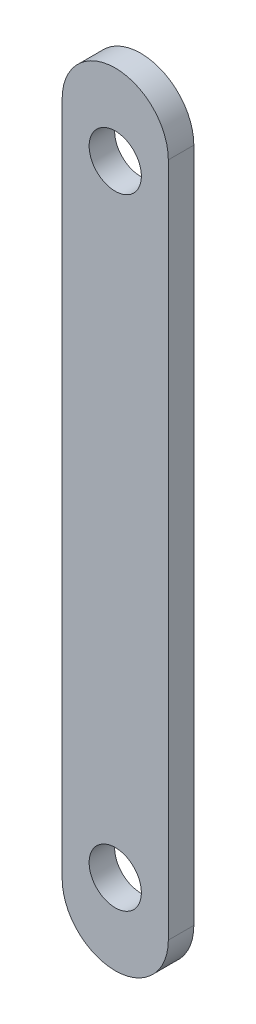
from build123d import *

# Parameters (mm, degrees)
IZIM1_R                     = 3.787969925
Y_KSEKLIK_EKSTR_ZYON1_DEPTH = 3.7


with BuildPart() as part:
    # Çizim1 → Yükseklik-Ekstrüzyon1 (new body)
    with BuildSketch(Plane.XY):
        with BuildLine():
            Line((-7.697744361, -49), (-7.697744361, 49))
            ThreePointArc((-7.697744361, 49), (0, 56.697744361), (7.697744361, 49))
            Line((7.697744361, 49), (7.697744361, -49))
            ThreePointArc((7.697744361, -49), (0, -56.697744361), (-7.697744361, -49))
        make_face()
        with Locations((0, -45)):
            Circle(IZIM1_R, mode=Mode.SUBTRACT)
        with Locations(Location((0, 45, 0), (0, 0, 180))):
            Circle(IZIM1_R, mode=Mode.SUBTRACT)
    extrude(amount=Y_KSEKLIK_EKSTR_ZYON1_DEPTH)


solid = part.part
